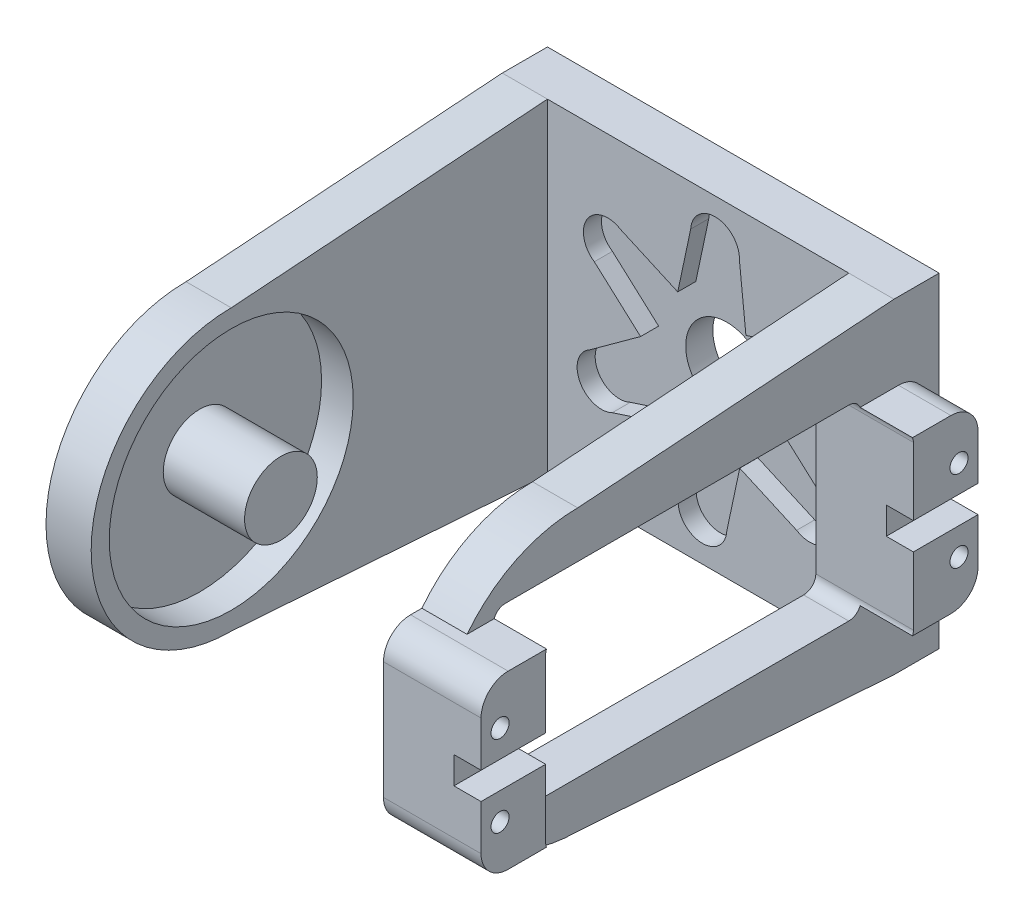
from build123d import *

# Parameters (mm, degrees)
SALIENTE_EXTRUIR1_START = 2.5
SALIENTE_EXTRUIR1_DEPTH = 5
CROQUIS2_R              = 13.5
CORTAR_EXTRUIR1_DEPTH   = 3.5
CROQUIS4_R              = 4.025
SALIENTE_EXTRUIR3_DEPTH = 9
CROQUIS5_W              = 5
CROQUIS5_H              = 36
SALIENTE_EXTRUIR4_DEPTH = 38.35
CORTAR_EXTRUIR2_DEPTH   = 2
CROQUIS8_R              = 4.55
CORTAR_EXTRUIR3_DEPTH   = 67.15821583
SALIENTE_EXTRUIR5_DEPTH = 5
CORTAR_EXTRUIR4_DEPTH   = 5
SALIENTE_EXTRUIR6_START = 3.65
CROQUIS12_R             = 1
SALIENTE_EXTRUIR6_DEPTH = 3.65
SALIENTE_EXTRUIR7_START = -8.65
SALIENTE_EXTRUIR7_DEPTH = 8.65
CROQUIS14_R             = 1
CORTAR_EXTRUIR5_DEPTH   = 3.65
CROQUIS15_W             = 7.15
CROQUIS15_H             = 2.35
CORTAR_EXTRUIR6_DEPTH   = 2
CROQUIS16_W             = 7.15
CROQUIS16_H             = 2.35
SALIENTE_EXTRUIR8_DEPTH = 2
SALIENTE_EXTRUIR9_START = 2.15
CROQUIS17_R             = 1
SALIENTE_EXTRUIR9_DEPTH = 2.15
CROQUIS18_W             = 55
CROQUIS18_H             = 3
CORTAR_EXTRUIR7_DEPTH   = 3


with BuildPart() as part:
    # Croquis1 → Saliente-Extruir1 (new body)
    with BuildSketch(Plane.ZY.offset(28.973126084).offset(SALIENTE_EXTRUIR1_START)):
        with BuildLine():
            Line((108.890000566, 10.898170258), (108.890000566, -25.101829742))
            Line((108.890000566, -25.101829742), (143.890000566, -22.601829742))
            ThreePointArc((143.890000566, -22.601829742), (159.390000566, -7.101829742), (143.890000566, 8.398170258))
            Line((143.890000566, 8.398170258), (108.890000566, 10.898170258))
        make_face()
    extrude(amount=-SALIENTE_EXTRUIR1_DEPTH)

    # Croquis2 → Cortar-Extruir1 (cut)
    with BuildSketch(Plane(origin=(-26.473126084, 0, 0), x_dir=(0, 0, -1), z_dir=(1, 0, 0))):
        with Locations((-143.890000566, -7.101829742)):
            Circle(CROQUIS2_R)
    extrude(amount=-CORTAR_EXTRUIR1_DEPTH, mode=Mode.SUBTRACT)

    # Croquis4 → Saliente-Extruir3 (add)
    with BuildSketch(Plane(origin=(-29.973126084, 0, 0), x_dir=(0, 0, -1), z_dir=(1, 0, 0))):
        with Locations(Location((-143.890000566, -7.101829742, 0), (0, 0, 180))):
            Circle(CROQUIS4_R)
    extrude(amount=SALIENTE_EXTRUIR3_DEPTH)

    # Croquis5 → Saliente-Extruir4 (add)
    with BuildSketch(Plane.ZY.offset(31.473126084)):
        with Locations((106.390000566, -7.101829742)):
            Rectangle(CROQUIS5_W, CROQUIS5_H)
    extrude(amount=-SALIENTE_EXTRUIR4_DEPTH)

    # Croquis6 → Cortar-Extruir2 (cut)
    with BuildSketch(Plane.XY.offset(108.890000566)):
        with BuildLine():
            Line((-21.743906953, -10.757089493), (-16.168906615, -6.706372141))
            Line((-16.168906615, -6.706372141), (-21.289951258, -2.095098824))
            ThreePointArc((-21.289951258, -2.095098824), (-22.060016072, 1.624188646), (-18.349064321, 2.433469933))
            Line((-18.349064321, 2.433469933), (-12.053540021, -0.36926331))
            Line((-12.053540021, -0.36926331), (-10.620582506, 6.371328103))
            ThreePointArc((-10.620582506, 6.371328103), (-7.784617481, 8.89786753), (-5.228283452, 6.088729685))
            Line((-5.228283452, 6.088729685), (-4.50775949, -0.764720911))
            Line((-4.50775949, -0.764720911), (2.046242668, 1.364597186))
            ThreePointArc((2.046242668, 1.364597186), (5.652272507, 0.171849142), (4.497654785, -3.44656999))
            Line((4.497654785, -3.44656999), (-1.077345553, -7.497287342))
            Line((-1.077345553, -7.497287342), (4.04369909, -12.108560659))
            ThreePointArc((4.04369909, -12.108560659), (4.813763904, -15.827848129), (1.102812153, -16.637129416))
            Line((1.102812153, -16.637129416), (-5.192712147, -13.834396173))
            Line((-5.192712147, -13.834396173), (-6.625669661, -20.574987586))
            ThreePointArc((-6.625669661, -20.574987586), (-9.461634687, -23.101527013), (-12.017968716, -20.292389168))
            Line((-12.017968716, -20.292389168), (-12.738492677, -13.438938572))
            Line((-12.738492677, -13.438938572), (-19.292494835, -15.568256669))
            ThreePointArc((-19.292494835, -15.568256669), (-22.898524675, -14.375508625), (-21.743906953, -10.757089493))
        make_face()
    extrude(amount=-CORTAR_EXTRUIR2_DEPTH, mode=Mode.SUBTRACT)

    # Croquis8 → Cortar-Extruir3 (cut, through all)
    with BuildSketch(Plane.XY.offset(106.890000566)):
        with Locations((-8.623126084, -7.101829742)):
            Circle(CROQUIS8_R)
    extrude(amount=-CORTAR_EXTRUIR3_DEPTH, mode=Mode.SUBTRACT)

    # Croquis9 → Saliente-Extruir5 (add)
    with BuildSketch(Plane(origin=(6.876873916, 0, 0), x_dir=(0, 0, -1), z_dir=(1, 0, 0))):
        with BuildLine():
            Line((-143.890000566, -22.601829742), (-108.890000566, -25.101829742))
            Line((-108.890000566, -25.101829742), (-103.890000566, -25.101829742))
            Line((-103.890000566, -25.101829742), (-103.890000566, 10.898170258))
            Line((-103.890000566, 10.898170258), (-108.890000566, 10.898170258))
            Line((-108.890000566, 10.898170258), (-143.890000566, 8.398170258))
            ThreePointArc((-143.890000566, 8.398170258), (-159.390000566, -7.101829742), (-143.890000566, -22.601829742))
        make_face()
    extrude(amount=SALIENTE_EXTRUIR5_DEPTH)

    # Croquis11 → Cortar-Extruir4 (cut)
    with BuildSketch(Plane(origin=(11.876873916, 0, 0), x_dir=(0, 0, -1), z_dir=(1, 0, 0))):
        with BuildLine():
            Line((-153.240000566, 1.898170258), (-153.240000566, -16.101829742))
            ThreePointArc((-153.240000566, -16.101829742), (-152.844594721, -17.056423896), (-151.890000566, -17.451829742))
            Line((-151.890000566, -17.451829742), (-113.890000566, -17.451829742))
            ThreePointArc((-113.890000566, -17.451829742), (-112.935406411, -17.056423896), (-112.540000566, -16.101829742))
            Line((-112.540000566, -16.101829742), (-112.540000566, 1.898170258))
            ThreePointArc((-112.540000566, 1.898170258), (-112.935406411, 2.852764413), (-113.890000566, 3.248170258))
            Line((-113.890000566, 3.248170258), (-151.890000566, 3.248170258))
            ThreePointArc((-151.890000566, 3.248170258), (-152.844594721, 2.852764413), (-153.240000566, 1.898170258))
        make_face()
    extrude(amount=-CORTAR_EXTRUIR4_DEPTH, mode=Mode.SUBTRACT)

    # Croquis12 → Saliente-Extruir6 (add)
    with BuildSketch(Plane(origin=(11.876873916, 0, 0), x_dir=(0, 0, -1), z_dir=(1, 0, 0)).offset(SALIENTE_EXTRUIR6_START)):
        with BuildLine():
            Line((-105.390000566, -1.251829742), (-105.390000566, -3.951829742))
            Line((-105.390000566, -3.951829742), (-105.390000566, -10.251829742))
            Line((-105.390000566, -10.251829742), (-105.390000566, -12.951829742))
            Line((-105.390000566, -12.951829742), (-105.390000566, -13.601829742))
            ThreePointArc((-105.390000566, -13.601829742), (-106.268680223, -15.723150085), (-108.390000566, -16.601829742))
            Line((-108.390000566, -16.601829742), (-112.636006946, -16.601829742))
            ThreePointArc((-112.636006946, -16.601829742), (-112.564219402, -16.356396641), (-112.540000566, -16.101829742))
            Line((-112.540000566, -16.101829742), (-112.540000566, 1.898170258))
            ThreePointArc((-112.540000566, 1.898170258), (-112.564219402, 2.152737158), (-112.636006946, 2.398170258))
            Line((-112.636006946, 2.398170258), (-108.390000566, 2.398170258))
            ThreePointArc((-108.390000566, 2.398170258), (-106.268680223, 1.519490602), (-105.390000566, -0.601829742))
            Line((-105.390000566, -0.601829742), (-105.390000566, -1.251829742))
        make_face()
        with Locations((-107.494163107, -2.601829742)):
            Circle(CROQUIS12_R, mode=Mode.SUBTRACT)
        with Locations((-107.494163107, -11.601829742)):
            Circle(CROQUIS12_R, mode=Mode.SUBTRACT)
    extrude(amount=-SALIENTE_EXTRUIR6_DEPTH)

    # Croquis13 → Saliente-Extruir7 (add)
    with BuildSketch(Plane.ZY.offset(-6.876873916).offset(SALIENTE_EXTRUIR7_START)):
        with BuildLine():
            Line((153.240000566, -16.101829742), (153.240000566, 1.898170258))
            ThreePointArc((153.240000566, 1.898170258), (153.21578173, 2.152737158), (153.143994186, 2.398170258))
            Line((153.143994186, 2.398170258), (157.390000566, 2.398170258))
            ThreePointArc((157.390000566, 2.398170258), (159.51132091, 1.519490602), (160.390000566, -0.601829742))
            Line((160.390000566, -0.601829742), (160.390000566, -1.251829742))
            Line((160.390000566, -1.251829742), (160.390000566, -3.951829742))
            Line((160.390000566, -3.951829742), (160.390000566, -10.251829742))
            Line((160.390000566, -10.251829742), (160.390000566, -12.951829742))
            Line((160.390000566, -12.951829742), (160.390000566, -13.601829742))
            ThreePointArc((160.390000566, -13.601829742), (159.51132091, -15.723150085), (157.390000566, -16.601829742))
            Line((157.390000566, -16.601829742), (153.143994186, -16.601829742))
            ThreePointArc((153.143994186, -16.601829742), (153.21578173, -16.356396641), (153.240000566, -16.101829742))
        make_face()
    extrude(amount=SALIENTE_EXTRUIR7_DEPTH)

    # Croquis14 → Cortar-Extruir5 (cut)
    with BuildSketch(Plane(origin=(15.526873916, 0, 0), x_dir=(0, 0, -1), z_dir=(1, 0, 0))):
        with Locations((-158.285838025, -2.601829742)):
            Circle(CROQUIS14_R)
        with Locations((-158.285838025, -11.601829742)):
            Circle(CROQUIS14_R)
    extrude(amount=-CORTAR_EXTRUIR5_DEPTH, mode=Mode.SUBTRACT)

    # Croquis15 → Cortar-Extruir6 (cut)
    with BuildSketch(Plane(origin=(15.526873916, 0, 0), x_dir=(0, 0, -1), z_dir=(1, 0, 0))):
        with Locations((-108.965000566, -7.101829742)):
            Rectangle(CROQUIS15_W, CROQUIS15_H)
        with Locations((-156.815000566, -7.101829742)):
            Rectangle(CROQUIS15_W, CROQUIS15_H)
    extrude(amount=-CORTAR_EXTRUIR6_DEPTH, mode=Mode.SUBTRACT)

    # Croquis16 → Saliente-Extruir8 (add)
    with BuildSketch(Plane(origin=(13.526873916, 0, 0), x_dir=(0, 0, -1), z_dir=(1, 0, 0))):
        with Locations((-156.815000566, -7.101829742)):
            Rectangle(CROQUIS16_W, CROQUIS16_H)
        with Locations((-108.965000566, -7.101829742)):
            Rectangle(CROQUIS16_W, CROQUIS16_H)
    extrude(amount=SALIENTE_EXTRUIR8_DEPTH)

    # Croquis17 → Saliente-Extruir9 (add)
    # profile 1 of 2: a face of its own
    with BuildSketch(Plane(origin=(15.526873916, 0, 0), x_dir=(0, 0, -1), z_dir=(1, 0, 0)).offset(SALIENTE_EXTRUIR9_START)):
        with BuildLine():
            Line((-105.390000566, -13.601829742), (-105.390000566, -0.601829742))
            ThreePointArc((-105.390000566, -0.601829742), (-106.268680223, 1.519490602), (-108.390000566, 2.398170258))
            Line((-108.390000566, 2.398170258), (-112.636006946, 2.398170258))
            ThreePointArc((-112.636006946, 2.398170258), (-112.564219402, 2.152737158), (-112.540000566, 1.898170258))
            Line((-112.540000566, 1.898170258), (-112.540000566, -16.101829742))
            ThreePointArc((-112.540000566, -16.101829742), (-112.564219402, -16.356396641), (-112.636006946, -16.601829742))
            Line((-112.636006946, -16.601829742), (-108.390000566, -16.601829742))
            ThreePointArc((-108.390000566, -16.601829742), (-106.268680223, -15.723150085), (-105.390000566, -13.601829742))
        make_face()
        with Locations((-107.494163107, -11.601829742)):
            Circle(CROQUIS17_R, mode=Mode.SUBTRACT)
        with Locations((-107.494163107, -2.601829742)):
            Circle(CROQUIS17_R, mode=Mode.SUBTRACT)
    # profile 2 of 2: a face of its own
    with BuildSketch(Plane(origin=(15.526873916, 0, 0), x_dir=(0, 0, -1), z_dir=(1, 0, 0)).offset(SALIENTE_EXTRUIR9_START)):
        with BuildLine():
            Line((-160.390000566, -0.601829742), (-160.390000566, -13.601829742))
            ThreePointArc((-160.390000566, -13.601829742), (-159.51132091, -15.723150085), (-157.390000566, -16.601829742))
            Line((-157.390000566, -16.601829742), (-153.143994186, -16.601829742))
            ThreePointArc((-153.143994186, -16.601829742), (-153.21578173, -16.356396641), (-153.240000566, -16.101829742))
            Line((-153.240000566, -16.101829742), (-153.240000566, 1.898170258))
            ThreePointArc((-153.240000566, 1.898170258), (-153.21578173, 2.152737158), (-153.143994186, 2.398170258))
            Line((-153.143994186, 2.398170258), (-157.390000566, 2.398170258))
            ThreePointArc((-157.390000566, 2.398170258), (-159.51132091, 1.519490602), (-160.390000566, -0.601829742))
        make_face()
        with Locations((-158.285838025, -11.601829742)):
            Circle(CROQUIS17_R, mode=Mode.SUBTRACT)
        with Locations((-158.285838025, -2.601829742)):
            Circle(CROQUIS17_R, mode=Mode.SUBTRACT)
    extrude(amount=-SALIENTE_EXTRUIR9_DEPTH)

    # Croquis18 → Cortar-Extruir7 (cut)
    with BuildSketch(Plane(origin=(17.676873916, 0, 0), x_dir=(0, 0, -1), z_dir=(1, 0, 0))):
        with Locations((-132.890000566, -7.101829742)):
            Rectangle(CROQUIS18_W, CROQUIS18_H)
    extrude(amount=-CORTAR_EXTRUIR7_DEPTH, mode=Mode.SUBTRACT)


solid = part.part
